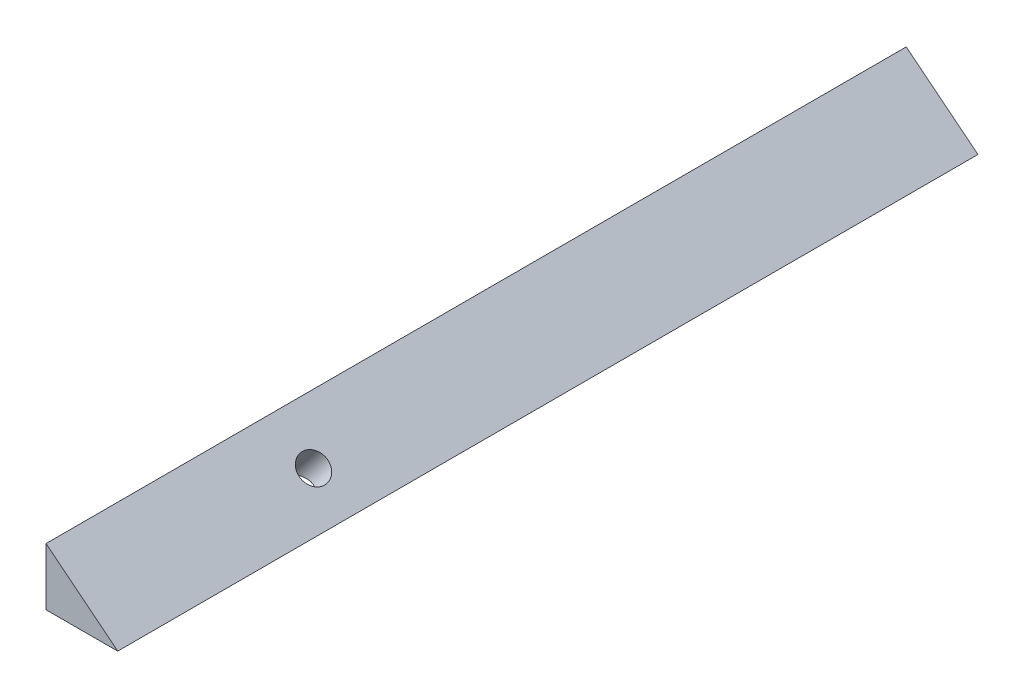
from build123d import *

# Parameters (mm, degrees)
BOSS_EXTRUDE1_DEPTH = 38.1
BOSS_EXTRUDE2_DEPTH = 292.1
BOSS_EXTRUDE3_DEPTH = 431.8
SKETCH6_R           = 12.7
CUT_EXTRUDE2_DEPTH  = 431.8


with BuildPart() as part:
    # Sketch1 → Boss-Extrude1 (new body)
    with BuildSketch(Plane.XY):
        Polygon((0, 0), (0, 50.8), (63.5, 0), align=None)
    extrude(amount=-BOSS_EXTRUDE1_DEPTH)

    # Sketch3 → Boss-Extrude2 (add)
    with BuildSketch(Plane.XY):
        Polygon((0, 50.8), (0, 0), (63.5, 0), align=None)
    extrude(amount=BOSS_EXTRUDE2_DEPTH)

    # Sketch4 → Boss-Extrude3 (add)
    with BuildSketch(Plane(origin=(0, 0, -38.1), x_dir=(-1, 0, 0), z_dir=(0, 0, -1))):
        Polygon((0, 50.8), (-63.5, 0), (0, 0), align=None)
    extrude(amount=BOSS_EXTRUDE3_DEPTH)

    # Sketch6 → Cut-Extrude2 (cut)
    with BuildSketch(Plane(origin=(24.780487805, 30.975609756, 0), x_dir=(0.7808688094430303, -0.6246950475544244, 0), z_dir=(0.6246950475544244, 0.7808688094430304, 0))):
        with Locations(Location((11.4851694, -88.9, 0), (0, 0, 180))):
            Circle(SKETCH6_R)
    extrude(amount=-CUT_EXTRUDE2_DEPTH, mode=Mode.SUBTRACT)


solid = part.part
